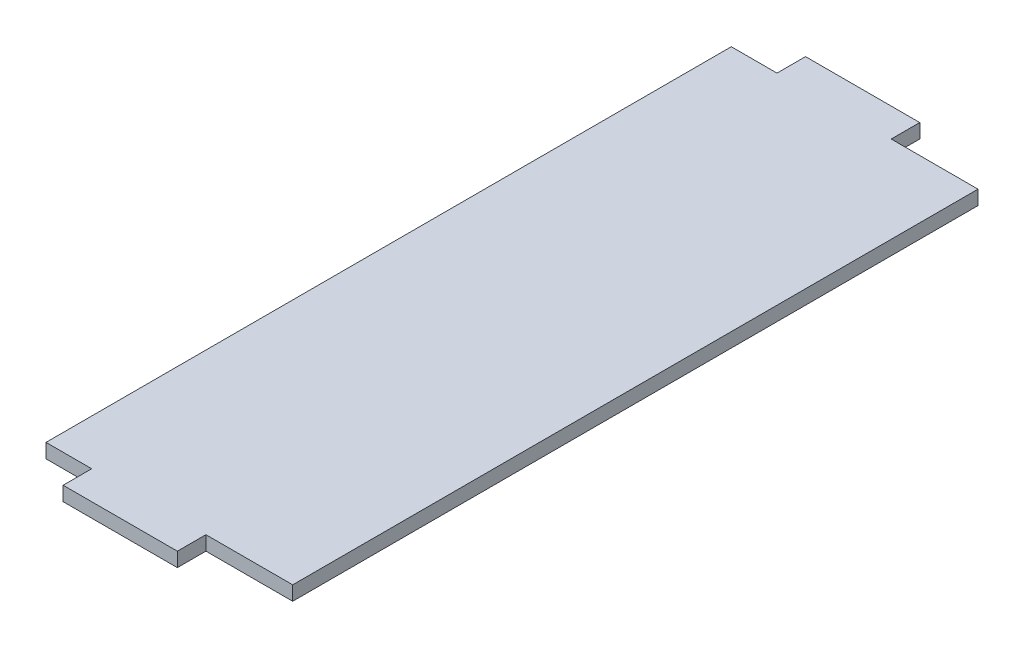
from build123d import *

# Parameters (mm, degrees)
SKETCH1_W           = 12.7
SKETCH1_H           = 76.2
SKETCH1_W_2         = 5.08
SKETCH1_W_3         = 9.652
SKETCH1_H_2         = 3.175
BOSS_EXTRUDE1_DEPTH = 1.5875


with BuildPart() as part:
    # Sketch1 → Boss-Extrude1 (new body)
    with BuildSketch(Plane(origin=(0, 0, 0), x_dir=(1, 0, 0), z_dir=(0, 1, 0))):
        with Locations((11.43, 38.1)):
            Rectangle(SKETCH1_W, SKETCH1_H)
        with Locations((2.54, 38.1)):
            Rectangle(SKETCH1_W_2, SKETCH1_H)
        with Locations((22.606, 38.1)):
            Rectangle(SKETCH1_W_3, SKETCH1_H)
        with Locations((11.43, -1.5875)):
            Rectangle(SKETCH1_W, SKETCH1_H_2)
        with Locations((11.43, 77.7875)):
            Rectangle(SKETCH1_W, SKETCH1_H_2)
    extrude(amount=BOSS_EXTRUDE1_DEPTH)


solid = part.part
